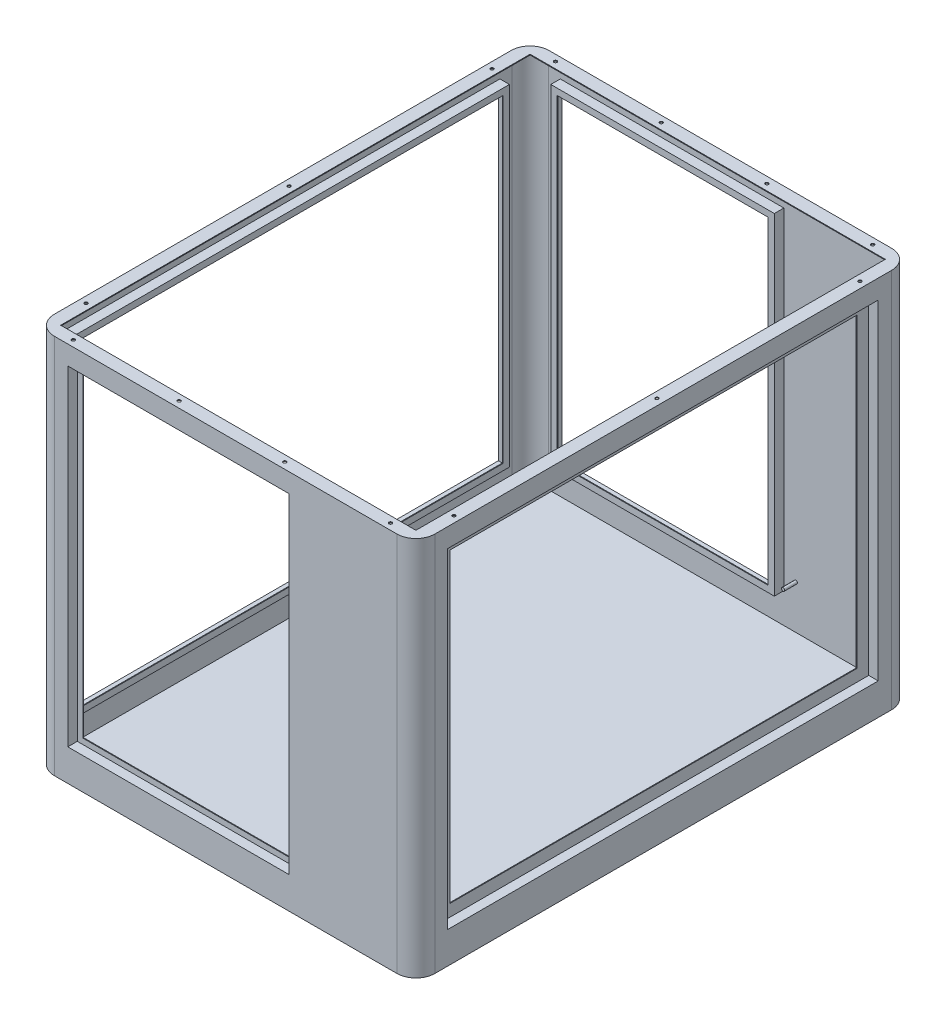
from build123d import *

# Parameters (mm, degrees)
SKETCH_1_W                  = 600
SKETCH_1_H                  = 600
EXTRUDE_1_DEPTH             = 780
FILLET_1_R                  = 30
SHELL_1_T                   = 1.2
SKETCH_13_W                 = 348.8
SKETCH_13_H                 = 520
CUT_EXTRUDE_6_DEPTH         = 10
SKETCH_15_W                 = 351.2
SKETCH_15_H                 = 522.4
SKETCH_15_W_2               = 348.8
SKETCH_15_H_2               = 520
EXTRUDE_7_DEPTH             = 15
SKETCH_16_W                 = 351.2
SKETCH_16_H                 = 522.4
SKETCH_16_W_2               = 331.2
SKETCH_16_H_2               = 502.4
EXTRUDE_8_DEPTH             = 1.2
SKETCH_17_W                 = 680
SKETCH_17_H                 = 520
CUT_EXTRUDE_7_DEPTH         = 1.2
SKETCH_19_W                 = 350
SKETCH_19_H                 = 520
CUT_EXTRUDE_8_DEPTH         = 1.2
SKETCH_22_W                 = 352.4
SKETCH_22_H                 = 522.4
SKETCH_22_W_2               = 350
SKETCH_22_H_2               = 520
EXTRUDE_9_DEPTH             = 15
SKETCH_23_W                 = 352.4
SKETCH_23_H                 = 522.4
SKETCH_23_W_2               = 332.4
SKETCH_23_H_2               = 502.4
EXTRUDE_10_DEPTH            = 1.2
SKETCH_24_W                 = 682.4
SKETCH_24_H                 = 522.4
SKETCH_24_W_2               = 680
SKETCH_24_H_2               = 520
EXTRUDE_11_DEPTH            = 15
SKETCH_26_W                 = 682.4
SKETCH_26_H                 = 522.4
SKETCH_26_W_2               = 662.4
SKETCH_26_H_2               = 502.4
EXTRUDE_12_DEPTH            = 1.2
SKETCH_27_W                 = 560
SKETCH_27_H                 = 740
CUT_EXTRUDE_9_DEPTH         = 10
PATTERN_LINEAR_1_COUNT      = 4
PATTERN_LINEAR_1_PITCH      = 166.666666667
HOLE_WIZARD_M6_2_AT_2_COUNT = 2
HOLE_WIZARD_M6_2_AT_2_PITCH = 320
HOLE_WIZARD_M6_2_AT_3_COUNT = 2
HOLE_WIZARD_M6_2_AT_3_PITCH = 640
SKETCH_32_W                 = 678.8
SKETCH_32_H                 = 520
CUT_EXTRUDE_10_DEPTH        = 10
SKETCH_33_W                 = 681.2
SKETCH_33_H                 = 522.4
SKETCH_33_W_2               = 678.8
SKETCH_33_H_2               = 520
EXTRUDE_13_DEPTH            = 15
SKETCH_34_W                 = 681.2
SKETCH_34_H                 = 522.4
SKETCH_34_W_2               = 641.2
SKETCH_34_H_2               = 482.4
EXTRUDE_14_DEPTH            = 1.2
SKETCH_35_R                 = 2.5
EXTRUDE_15_DEPTH            = 20
EXTRUDE_START               = 20
SKETCH_36_R                 = 2.5
EXTRUDE_16_DEPTH            = 20


with BuildPart() as part:
    # 草图1 → 凸台-拉伸1 (new body)
    with BuildSketch(Plane.XY):
        Rectangle(SKETCH_1_W, SKETCH_1_H)
    extrude(amount=EXTRUDE_1_DEPTH)

    # 圆角1
    fillet_1_edges = [part.edges().sort_by_distance(p)[0] for p in [
        (-300, 0, 780),
        (300, 0, 780),
        (-300, 0, 0),
        (300, 0, 0),
    ]]
    fillet(fillet_1_edges, radius=FILLET_1_R)

    # 抽壳1 (no face opened: a closed hollow body)
    add(offset(amount=-SHELL_1_T, mode=Mode.PRIVATE), mode=Mode.SUBTRACT)

    # 草图13 → 切除-拉伸6 (cut)
    with BuildSketch(Plane.XY.offset(780)):
        with Locations((-74.4, 10)):
            Rectangle(SKETCH_13_W, SKETCH_13_H)
    extrude(amount=-CUT_EXTRUDE_6_DEPTH, mode=Mode.SUBTRACT)

    # 草图15 → 凸台-拉伸7 (add)
    with BuildSketch(Plane.XY.offset(780)):
        with Locations((-74.4, 10)):
            Rectangle(SKETCH_15_W, SKETCH_15_H)
        with Locations((-74.4, 10)):
            Rectangle(SKETCH_15_W_2, SKETCH_15_H_2, mode=Mode.SUBTRACT)
    extrude(amount=-EXTRUDE_7_DEPTH)

    # 草图16 → 凸台-拉伸8 (add)
    with BuildSketch(Plane(origin=(0, 0, 765), x_dir=(-1, 0, 0), z_dir=(0, 0, -1))):
        with Locations((74.4, 10)):
            Rectangle(SKETCH_16_W, SKETCH_16_H)
        with Locations((74.4, 10)):
            Rectangle(SKETCH_16_W_2, SKETCH_16_H_2, mode=Mode.SUBTRACT)
    extrude(amount=EXTRUDE_8_DEPTH)

    # 草图17 → 切除-拉伸7 (cut)
    with BuildSketch(Plane(origin=(-300, 0, 0), x_dir=(0, 0, -1), z_dir=(1, 0, 0))):
        with Locations((-390, 10)):
            Rectangle(SKETCH_17_W, SKETCH_17_H)
    extrude(amount=CUT_EXTRUDE_7_DEPTH, mode=Mode.SUBTRACT)

    # 草图19 → 切除-拉伸8 (cut)
    with BuildSketch(Plane(origin=(0, 0, 0), x_dir=(-1, 0, 0), z_dir=(0, 0, -1))):
        with Locations((75, 10)):
            Rectangle(SKETCH_19_W, SKETCH_19_H)
    extrude(amount=-CUT_EXTRUDE_8_DEPTH, mode=Mode.SUBTRACT)

    # 草图22 → 凸台-拉伸9 (add)
    with BuildSketch(Plane(origin=(0, 0, 0), x_dir=(-1, 0, 0), z_dir=(0, 0, -1))):
        with Locations((75, 10)):
            Rectangle(SKETCH_22_W, SKETCH_22_H)
        with Locations((75, 10)):
            Rectangle(SKETCH_22_W_2, SKETCH_22_H_2, mode=Mode.SUBTRACT)
    extrude(amount=-EXTRUDE_9_DEPTH)

    # 草图23 → 凸台-拉伸10 (add)
    with BuildSketch(Plane.XY.offset(15)):
        with Locations((-75, 10)):
            Rectangle(SKETCH_23_W, SKETCH_23_H)
        with Locations((-75, 10)):
            Rectangle(SKETCH_23_W_2, SKETCH_23_H_2, mode=Mode.SUBTRACT)
    extrude(amount=EXTRUDE_10_DEPTH)

    # 草图24 → 凸台-拉伸11 (add)
    with BuildSketch(Plane(origin=(-300, 0, 0), x_dir=(0, 0, -1), z_dir=(1, 0, 0))):
        with Locations((-390, 10)):
            Rectangle(SKETCH_24_W, SKETCH_24_H)
        with Locations((-390, 10)):
            Rectangle(SKETCH_24_W_2, SKETCH_24_H_2, mode=Mode.SUBTRACT)
    extrude(amount=EXTRUDE_11_DEPTH)

    # 草图26 → 凸台-拉伸12 (add)
    with BuildSketch(Plane(origin=(-285, 0, 0), x_dir=(0, 0, -1), z_dir=(1, 0, 0))):
        with Locations((-390, 10)):
            Rectangle(SKETCH_26_W, SKETCH_26_H)
        with Locations((-390, 10)):
            Rectangle(SKETCH_26_W_2, SKETCH_26_H_2, mode=Mode.SUBTRACT)
    extrude(amount=EXTRUDE_12_DEPTH)

    # 草图27 → 切除-拉伸9 (cut)
    with BuildSketch(Plane(origin=(0, 300, 0), x_dir=(1, 0, 0), z_dir=(0, 1, 0))):
        with Locations((0, -390)):
            Rectangle(SKETCH_27_W, SKETCH_27_H)
    extrude(amount=-CUT_EXTRUDE_9_DEPTH, mode=Mode.SUBTRACT)

    # 草图29 → M6 螺纹孔1 (revolve, cut)
    with BuildSketch(Plane(origin=(250, 300, 770), x_dir=(0, 0, 1), z_dir=(1, 0, 0))):
        Polygon((0, 0), (0, 16.502151548), (2.5, 15), (2.5, 0), align=None)
    hole_wizard_m6_1 = revolve(axis=Axis((250, 306.35, 770), (0, -1, 0)), mode=Mode.SUBTRACT)

    # 阵列(线性)1: M6 螺纹孔1 ×4
    with Locations(*[(-i * PATTERN_LINEAR_1_PITCH, 0, 0) for i in range(1, PATTERN_LINEAR_1_COUNT)]):
        add(hole_wizard_m6_1, mode=Mode.SUBTRACT)

    # 镜向1: M6 螺纹孔1 across plane
    add(hole_wizard_m6_1.mirror(Plane(origin=(0, 0, 390), x_dir=(1, 0, 0), z_dir=(0, 0, -1))), mode=Mode.SUBTRACT)

    # 镜向1 copy 1 sketch → 镜向1 copy 1 (revolve, cut)
    with BuildSketch(Plane(origin=(83.333333333, 300, 10), x_dir=(0, 0, -1), z_dir=(1, 0, 0))):
        Polygon((0, 0), (0, -16.502151548), (2.5, -15), (2.5, 0), align=None)
    revolve(axis=Axis((83.333333333, 306.35, 10), (0, 1, 0)), mode=Mode.SUBTRACT)

    # 镜向1 copy 2 sketch → 镜向1 copy 2 (revolve, cut)
    with BuildSketch(Plane(origin=(-83.333333333, 300, 10), x_dir=(0, 0, -1), z_dir=(1, 0, 0))):
        Polygon((0, 0), (0, -16.502151548), (2.5, -15), (2.5, 0), align=None)
    revolve(axis=Axis((-83.333333333, 306.35, 10), (0, 1, 0)), mode=Mode.SUBTRACT)

    # 镜向1 copy 3 sketch → 镜向1 copy 3 (revolve, cut)
    with BuildSketch(Plane(origin=(-250, 300, 10), x_dir=(0, 0, -1), z_dir=(1, 0, 0))):
        Polygon((0, 0), (0, -16.502151548), (2.5, -15), (2.5, 0), align=None)
    revolve(axis=Axis((-250, 306.35, 10), (0, 1, 0)), mode=Mode.SUBTRACT)

    # 草图31 → M6 螺纹孔2 (revolve, cut)
    with BuildSketch(Plane(origin=(290, 300, 710), x_dir=(0, 0, 1), z_dir=(1, 0, 0))):
        Polygon((0, 0), (0, 16.502151548), (2.5, 15), (2.5, 0), align=None)
    hole_wizard_m6_2 = revolve(axis=Axis((290, 306.35, 710), (0, -1, 0)), mode=Mode.SUBTRACT)

    # M6 螺纹孔2 at 2: M6 螺纹孔2 ×2
    with Locations(*[(0, 0, -i * HOLE_WIZARD_M6_2_AT_2_PITCH) for i in range(1, HOLE_WIZARD_M6_2_AT_2_COUNT)]):
        add(hole_wizard_m6_2, mode=Mode.SUBTRACT)

    # M6 螺纹孔2 at 3: M6 螺纹孔2 ×2
    with Locations(*[(0, 0, -i * HOLE_WIZARD_M6_2_AT_3_PITCH) for i in range(1, HOLE_WIZARD_M6_2_AT_3_COUNT)]):
        add(hole_wizard_m6_2, mode=Mode.SUBTRACT)

    # 镜向2: M6 螺纹孔2 across plane
    add(hole_wizard_m6_2.mirror(Plane(origin=(0, 0, 0), x_dir=(0, 0, 1), z_dir=(1, 0, 0))), mode=Mode.SUBTRACT)

    # 镜向2 copy 1 sketch → 镜向2 copy 1 (revolve, cut)
    with BuildSketch(Plane(origin=(-290, 300, 390), x_dir=(0, 0, 1), z_dir=(-1, 0, 0))):
        Polygon((0, 0), (0, -16.502151548), (2.5, -15), (2.5, 0), align=None)
    revolve(axis=Axis((-290, 306.35, 390), (0, 1, 0)), mode=Mode.SUBTRACT)

    # 镜向2 copy 2 sketch → 镜向2 copy 2 (revolve, cut)
    with BuildSketch(Plane(origin=(-290, 300, 70), x_dir=(0, 0, 1), z_dir=(-1, 0, 0))):
        Polygon((0, 0), (0, -16.502151548), (2.5, -15), (2.5, 0), align=None)
    revolve(axis=Axis((-290, 306.35, 70), (0, 1, 0)), mode=Mode.SUBTRACT)

    # 镜向3: M6 螺纹孔2 across plane
    add(hole_wizard_m6_2.mirror(Plane(origin=(0, 0, 0), x_dir=(0, 0, 1), z_dir=(1, 0, 0))), mode=Mode.SUBTRACT)

    # 镜向3 copy 1 sketch → 镜向3 copy 1 (revolve, cut)
    with BuildSketch(Plane(origin=(-290, 300, 390), x_dir=(0, 0, 1), z_dir=(-1, 0, 0))):
        Polygon((0, 0), (0, -16.502151548), (2.5, -15), (2.5, 0), align=None)
    revolve(axis=Axis((-290, 306.35, 390), (0, 1, 0)), mode=Mode.SUBTRACT)

    # 镜向3 copy 2 sketch → 镜向3 copy 2 (revolve, cut)
    with BuildSketch(Plane(origin=(-290, 300, 70), x_dir=(0, 0, 1), z_dir=(-1, 0, 0))):
        Polygon((0, 0), (0, -16.502151548), (2.5, -15), (2.5, 0), align=None)
    revolve(axis=Axis((-290, 306.35, 70), (0, 1, 0)), mode=Mode.SUBTRACT)

    # 草图32 → 切除-拉伸10 (cut)
    with BuildSketch(Plane(origin=(300, 0, 0), x_dir=(0, 0, -1), z_dir=(1, 0, 0))):
        with Locations((-390.6, 10)):
            Rectangle(SKETCH_32_W, SKETCH_32_H)
    extrude(amount=-CUT_EXTRUDE_10_DEPTH, mode=Mode.SUBTRACT)

    # 草图33 → 凸台-拉伸13 (add)
    with BuildSketch(Plane(origin=(300, 0, 0), x_dir=(0, 0, -1), z_dir=(1, 0, 0))):
        with Locations((-390.6, 10)):
            Rectangle(SKETCH_33_W, SKETCH_33_H)
        with Locations((-390.6, 10)):
            Rectangle(SKETCH_33_W_2, SKETCH_33_H_2, mode=Mode.SUBTRACT)
    extrude(amount=-EXTRUDE_13_DEPTH)

    # 草图34 → 凸台-拉伸14 (add)
    with BuildSketch(Plane.ZY.offset(-285)):
        with Locations((390.6, 10)):
            Rectangle(SKETCH_34_W, SKETCH_34_H)
        with Locations((390.6, 10)):
            Rectangle(SKETCH_34_W_2, SKETCH_34_H_2, mode=Mode.SUBTRACT)
    extrude(amount=EXTRUDE_14_DEPTH)

    # 草图35 → 凸台-拉伸15 (add)
    with BuildSketch(Plane(origin=(0, 0, 778.8), x_dir=(-1, 0, 0), z_dir=(0, 0, -1))):
        with Locations((-120, 120)):
            Circle(SKETCH_35_R)
        with Locations((-120, -230)):
            Circle(SKETCH_35_R)
    extrude(amount=EXTRUDE_15_DEPTH)

    # 草图36 → 凸台-拉伸16 (add)
    with BuildSketch(Plane.XY.offset(1.2).offset(EXTRUDE_START)):
        with Locations(Location((120, 120, 0), (0, 0, 180))):
            Circle(SKETCH_36_R)
        with Locations(Location((120, -230, 0), (0, 0, 180))):
            Circle(SKETCH_36_R)
    extrude(amount=-EXTRUDE_16_DEPTH)


solid = part.part
